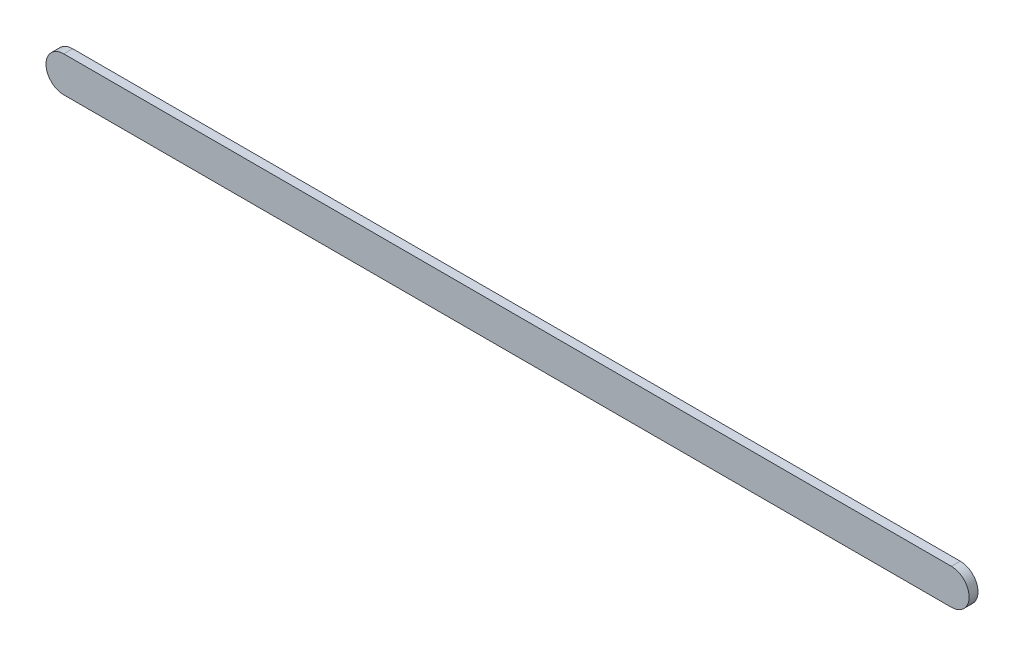
from build123d import *

# Parameters (mm, degrees)
BOSS_EXTRUDE1_DEPTH = 2.5


with BuildPart() as part:
    # Sketch1 → Boss-Extrude1 (new body)
    with BuildSketch(Plane.XY):
        with BuildLine():
            Line((-53.333333333, -0.166666667), (196.666666667, -0.166666667))
            ThreePointArc((196.666666667, -0.166666667), (201.666666667, -5.166666667), (196.666666667, -10.166666667))
            Line((196.666666667, -10.166666667), (-53.333333333, -10.166666667))
            ThreePointArc((-53.333333333, -10.166666667), (-58.333333333, -5.166666667), (-53.333333333, -0.166666667))
        make_face()
    extrude(amount=BOSS_EXTRUDE1_DEPTH)


solid = part.part
